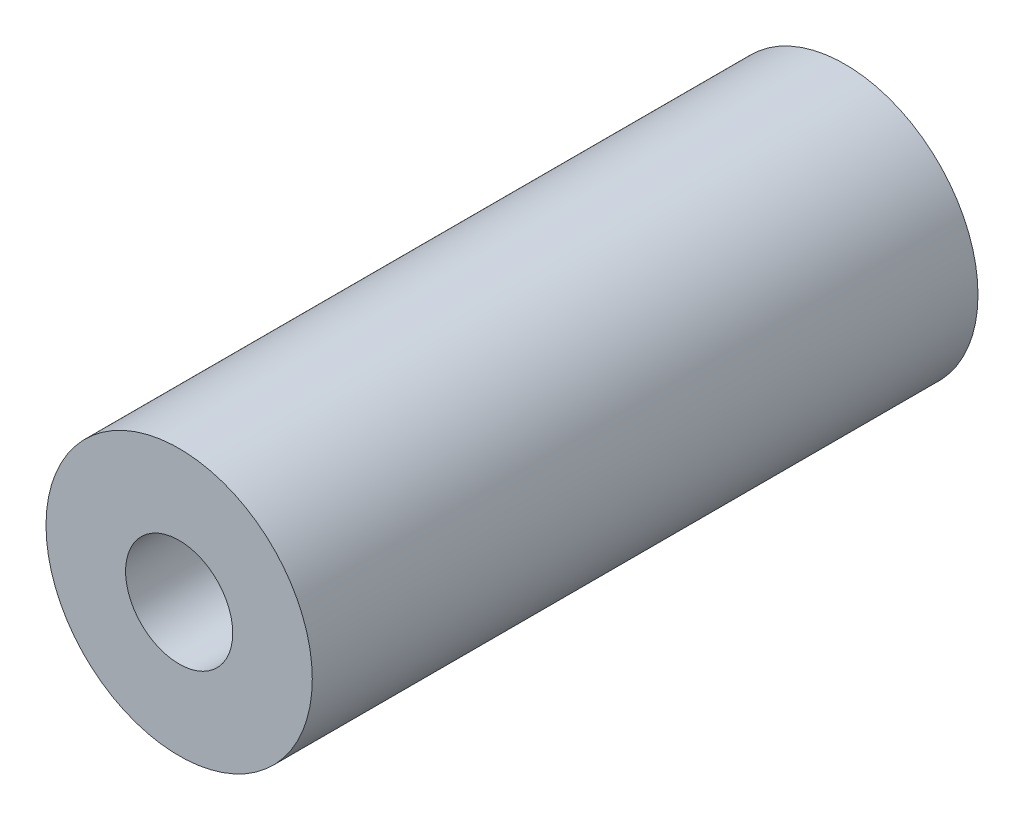
from build123d import *

# Parameters (mm, degrees)
SKETCH1_R           = 6.35
SKETCH1_R_2         = 2.555
BOSS_EXTRUDE1_DEPTH = 31.75


with BuildPart() as part:
    # Sketch1 → Boss-Extrude1 (new body)
    with BuildSketch(Plane.XY):
        Circle(SKETCH1_R)
        Circle(SKETCH1_R_2, mode=Mode.SUBTRACT)
    extrude(amount=BOSS_EXTRUDE1_DEPTH)


solid = part.part
